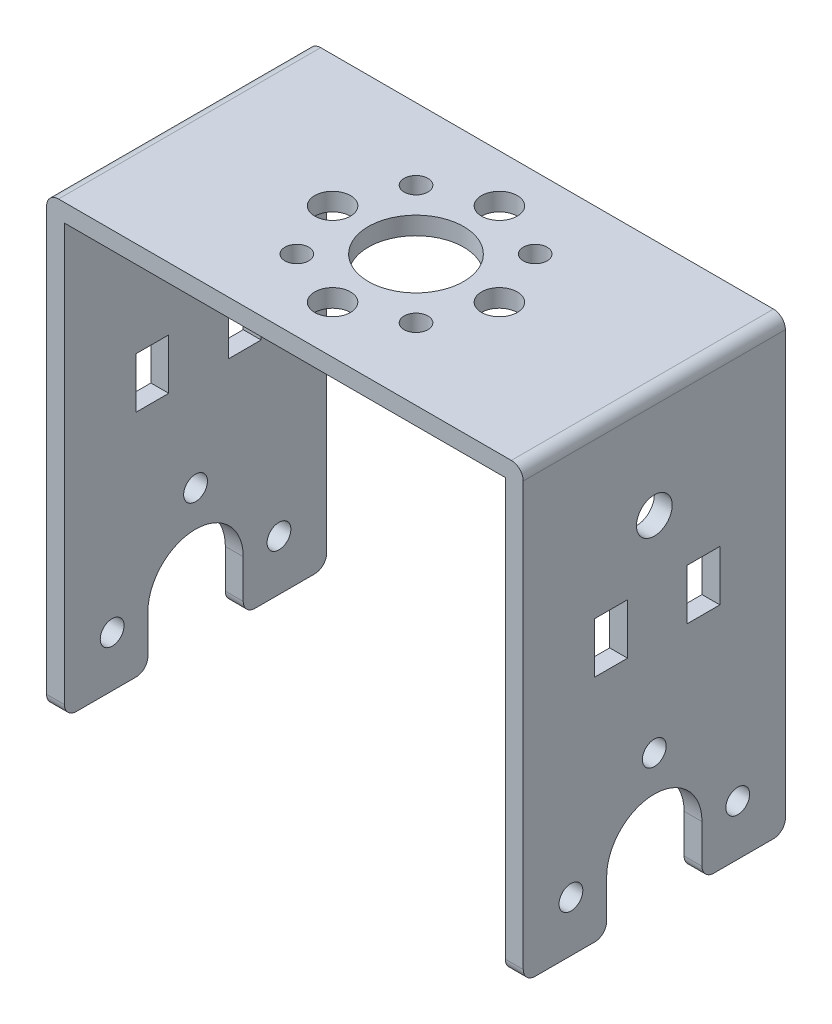
from build123d import *

# Parameters (mm, degrees)
SKETCH1_W           = 40
SKETCH1_H           = 22
SKETCH1_R           = 4
SKETCH1_R_2         = 1.5
SKETCH1_R_3         = 1
BOSS_EXTRUDE1_DEPTH = 1.5
SKETCH2_W           = 1.5
SKETCH2_H           = 22
BOSS_EXTRUDE2_DEPTH = 36
FILLET1_R           = 1
SKETCH3_R           = 1.5
SKETCH3_R_2         = 1
SKETCH3_W           = 2.75
SKETCH3_H           = 4.25
CUT_EXTRUDE1_DEPTH  = 55.927224579
FILLET2_R           = 1


with BuildPart() as part:
    # Sketch1 → Boss-Extrude1 (new body)
    with BuildSketch(Plane(origin=(0, 0, 0), x_dir=(1, 0, 0), z_dir=(0, 1, 0))):
        Rectangle(SKETCH1_W, SKETCH1_H)
        with Locations(Location((0, 0, 0), (0, 0, 270))):
            Circle(SKETCH1_R, mode=Mode.SUBTRACT)
        with Locations(Location((0, 7, 0), (0, 0, 270))):
            Circle(SKETCH1_R_2, mode=Mode.SUBTRACT)
        with Locations(Location((7, 0, 0), (0, 0, 270))):
            Circle(SKETCH1_R_2, mode=Mode.SUBTRACT)
        with Locations(Location((0, -7, 0), (0, 0, 270))):
            Circle(SKETCH1_R_2, mode=Mode.SUBTRACT)
        with Locations(Location((-7, 0, 0), (0, 0, 270))):
            Circle(SKETCH1_R_2, mode=Mode.SUBTRACT)
        with Locations(Location((5, 5, 0), (0, 0, 270))):
            Circle(SKETCH1_R_3, mode=Mode.SUBTRACT)
        with Locations(Location((5, -5, 0), (0, 0, 270))):
            Circle(SKETCH1_R_3, mode=Mode.SUBTRACT)
        with Locations(Location((-5, -5, 0), (0, 0, 270))):
            Circle(SKETCH1_R_3, mode=Mode.SUBTRACT)
        with Locations(Location((-5, 5, 0), (0, 0, 270))):
            Circle(SKETCH1_R_3, mode=Mode.SUBTRACT)
    extrude(amount=BOSS_EXTRUDE1_DEPTH)

    # Sketch2 → Boss-Extrude2 (add)
    with BuildSketch(Plane(origin=(0, 0, 0), x_dir=(-1, 0, 0), z_dir=(0, -1, 0))):
        with Locations((-19.25, 0)):
            Rectangle(SKETCH2_W, SKETCH2_H)
    boss_extrude2 = extrude(amount=BOSS_EXTRUDE2_DEPTH)

    # Mirror1: Boss-Extrude2 across plane
    add(boss_extrude2.mirror(Plane(origin=(0, 0, 0), x_dir=(0, 0, 1), z_dir=(1, 0, 0))))

    # Fillet1
    fillet1_edges = [part.edges().sort_by_distance(p)[0] for p in [
        (-20, 1.5, 0),
        (20, 1.5, 0),
    ]]
    fillet(fillet1_edges, radius=FILLET1_R)

    # Sketch3 → Cut-Extrude1 (cut, through all)
    with BuildSketch(Plane.ZY.offset(20)):
        with Locations((0, -7.5)):
            Circle(SKETCH3_R)
        with Locations((0, -24.75)):
            Circle(SKETCH3_R_2)
        with Locations((-7, -31.75)):
            Circle(SKETCH3_R_2)
        with Locations((7, -31.75)):
            Circle(SKETCH3_R_2)
        with BuildLine():
            Line((-4, -31.75), (-4, -36))
            Line((-4, -36), (4, -36))
            Line((4, -36), (4, -31.75))
            ThreePointArc((4, -31.75), (0, -27.75), (-4, -31.75))
        make_face()
        with Locations((-4.125, -14.625)):
            Rectangle(SKETCH3_W, SKETCH3_H)
        with Locations((3.625, -14.625)):
            Rectangle(SKETCH3_W, SKETCH3_H)
    extrude(amount=-CUT_EXTRUDE1_DEPTH, mode=Mode.SUBTRACT)

    # Fillet2
    fillet2_edges = [part.edges().sort_by_distance(p)[0] for p in [
        (-19.25, -36, -4),
        (-19.25, -36, 4),
        (19.25, -36, 4),
        (19.25, -36, -4),
        (19.25, -36, 11),
        (19.25, -36, -11),
        (-19.25, -36, -11),
        (-19.25, -36, 11),
    ]]
    fillet(fillet2_edges, radius=FILLET2_R)


solid = part.part
